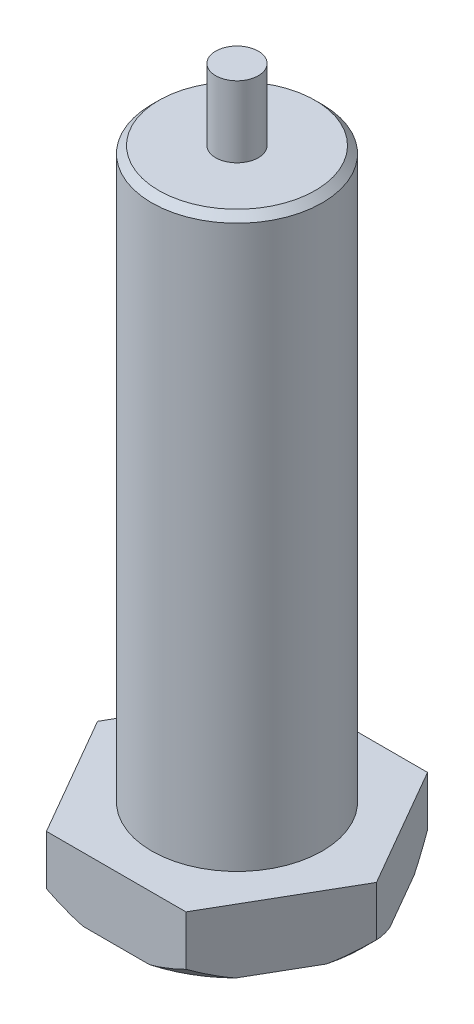
from build123d import *

# Parameters (mm, degrees)
P_IDAT_VYSUNUT_M1_DEPTH = 4.5
SKICA2_R                = 6
P_IDAT_VYSUNUT_M2_DEPTH = 40
SKICA3_R                = 1.5
P_IDAT_VYSUNUT_M3_DEPTH = 5
ZKOSEN_1_SIZE           = 0.5


with BuildPart() as part:
    # Skica1 → Přidat vysunutím1 (new body)
    with BuildSketch(Plane(origin=(0, 0, 0), x_dir=(1, 0, 0), z_dir=(0, 1, 0))):
        Polygon((9.814954576, 0), (4.907477288, 8.5), (-4.907477288, 8.5), (-9.814954576, 0), (-4.907477288, -8.5), (4.907477288, -8.5), align=None)
    extrude(amount=P_IDAT_VYSUNUT_M1_DEPTH)

    # Skica2 → Přidat vysunutím2 (add)
    with BuildSketch(Plane(origin=(0, 4.5, 0), x_dir=(1, 0, 0), z_dir=(0, 1, 0))):
        with Locations(Location((0, 0, 0), (0, 0, 270))):
            Circle(SKICA2_R)
    extrude(amount=P_IDAT_VYSUNUT_M2_DEPTH)

    # Skica3 → Přidat vysunutím3 (add)
    with BuildSketch(Plane(origin=(0, 44.5, 0), x_dir=(1, 0, 0), z_dir=(0, 1, 0))):
        with Locations(Location((0, 0, 0), (0, 0, 270))):
            Circle(SKICA3_R)
    extrude(amount=P_IDAT_VYSUNUT_M3_DEPTH)

    # Skica4 → Odebrat rotací1 (revolve, cut)
    with BuildSketch(Plane.XY):
        Polygon((-9.814954576, 0.999848989), (-8.815105588, 0), (-9.814954576, 0), align=None)
    revolve(axis=Axis((0, 0, 0), (0, 1, 0)), mode=Mode.SUBTRACT)

    # Zkosení1
    zkosen_1_edges = [part.edges().sort_by_distance(p)[0] for p in [
        (0, 44.5, -6),
    ]]
    chamfer(zkosen_1_edges, length=ZKOSEN_1_SIZE)


solid = part.part
